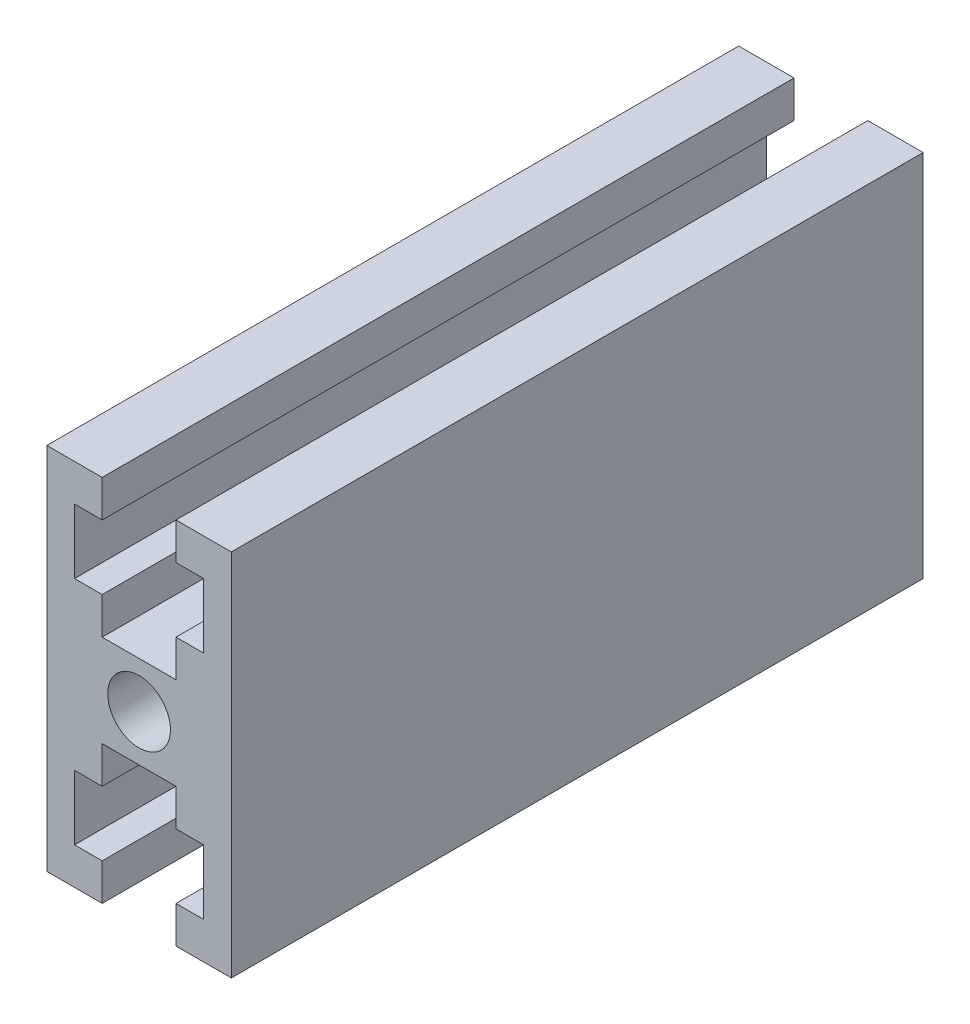
from build123d import *

# Parameters (mm, degrees)
SKETCH_2_R      = 3.4
EXTRUDE_1_DEPTH = 75


with BuildPart() as part:
    # 草图2 → 凸台-拉伸1 (new body)
    with BuildSketch(Plane.XY):
        Polygon((0, 0), (6, 0), (6, -4), (3, -4), (3, -11), (6, -11), (6, -15), (14, -15), (14, -11), (17, -11), (17, -4), (14, -4), (14, 0), (20, 0), (20, -40), (14, -40), (14, -36), (17, -36), (17, -29), (14, -29), (14, -25), (6, -25), (6, -29), (3, -29), (3, -36), (6, -36), (6, -40), (0, -40), align=None)
        with Locations(Location((10, -20, 0), (0, 0, 180))):
            Circle(SKETCH_2_R, mode=Mode.SUBTRACT)
    extrude(amount=EXTRUDE_1_DEPTH)


solid = part.part
